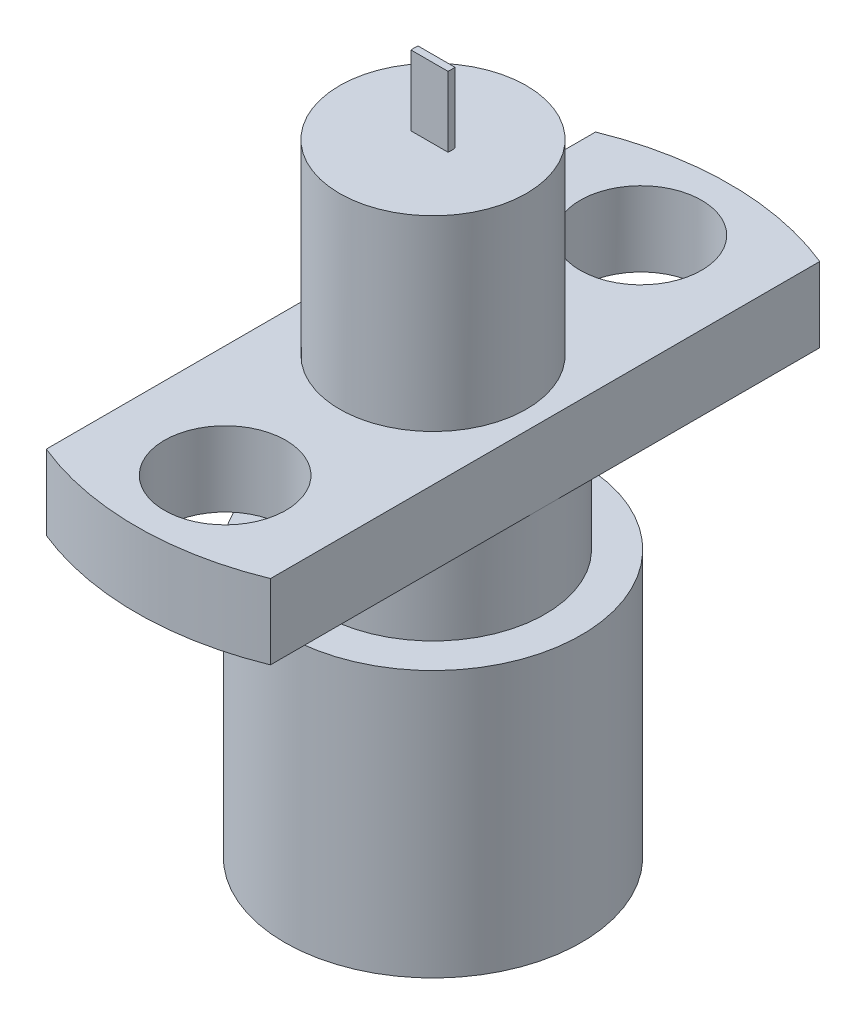
from build123d import *

# Parameters (mm, degrees)
BOSS_EXTRUDE1_DEPTH = 1.6
SKETCH2_R           = 1.3
CUT_EXTRUDE1_DEPTH  = 1.6
SKETCH3_R           = 2
BOSS_EXTRUDE2_DEPTH = 4
BOSS_EXTRUDE3_DEPTH = 1.5
SKETCH5_R           = 2.4
BOSS_EXTRUDE5_DEPTH = 2
SKETCH6_R           = 3.175
BOSS_EXTRUDE7_DEPTH = 5.7


with BuildPart() as part:
    # Sketch1 → Boss-Extrude1 (new body)
    with BuildSketch(Plane(origin=(0, 0, 0), x_dir=(1, 0, 0), z_dir=(0, 1, 0))):
        with BuildLine():
            Line((-2.4, 5.878988008), (-2.4, -5.878988008))
            ThreePointArc((-2.4, -5.878988008), (0, -6.35), (2.4, -5.878988008))
            Line((2.4, -5.878988008), (2.4, 5.878988008))
            ThreePointArc((2.4, 5.878988008), (0, 6.35), (-2.4, 5.878988008))
        make_face()
    extrude(amount=BOSS_EXTRUDE1_DEPTH)

    # Sketch2 → Cut-Extrude1 (cut)
    with BuildSketch(Plane(origin=(0, 1.6, 0), x_dir=(1, 0, 0), z_dir=(0, 1, 0))):
        with Locations(Location((0, 4.45, 0), (0, 0, 270))):
            Circle(SKETCH2_R)
        with Locations(Location((0, -4.45, 0), (0, 0, 90))):
            Circle(SKETCH2_R)
    extrude(amount=-CUT_EXTRUDE1_DEPTH, mode=Mode.SUBTRACT)

    # Sketch3 → Boss-Extrude2 (add)
    with BuildSketch(Plane(origin=(0, 1.6, 0), x_dir=(1, 0, 0), z_dir=(0, 1, 0))):
        with Locations(Location((0, 0, 0), (0, 0, 90))):
            Circle(SKETCH3_R)
    extrude(amount=BOSS_EXTRUDE2_DEPTH)

    # Sketch4 → Boss-Extrude3 (add)
    with BuildSketch(Plane(origin=(0, 5.6, 0), x_dir=(1, 0, 0), z_dir=(0, 1, 0))):
        with BuildLine():
            Line((0.392905841, 0.075), (-0.392905841, 0.075))
            ThreePointArc((-0.392905841, 0.075), (-0.4, 0), (-0.392905841, -0.075))
            Line((-0.392905841, -0.075), (0.392905841, -0.075))
            ThreePointArc((0.392905841, -0.075), (0.4, 0), (0.392905841, 0.075))
        make_face()
    extrude(amount=BOSS_EXTRUDE3_DEPTH)

    # Sketch5 → Boss-Extrude5 (add)
    with BuildSketch(Plane.XZ):
        with Locations(Location((0, 0, 0), (0, 0, 180))):
            Circle(SKETCH5_R)
    extrude(amount=BOSS_EXTRUDE5_DEPTH)

    # Sketch6 → Boss-Extrude7 (add)
    with BuildSketch(Plane.XZ.offset(2)):
        with Locations(Location((0, 0, 0), (0, 0, 90))):
            Circle(SKETCH6_R)
    extrude(amount=BOSS_EXTRUDE7_DEPTH)


solid = part.part
